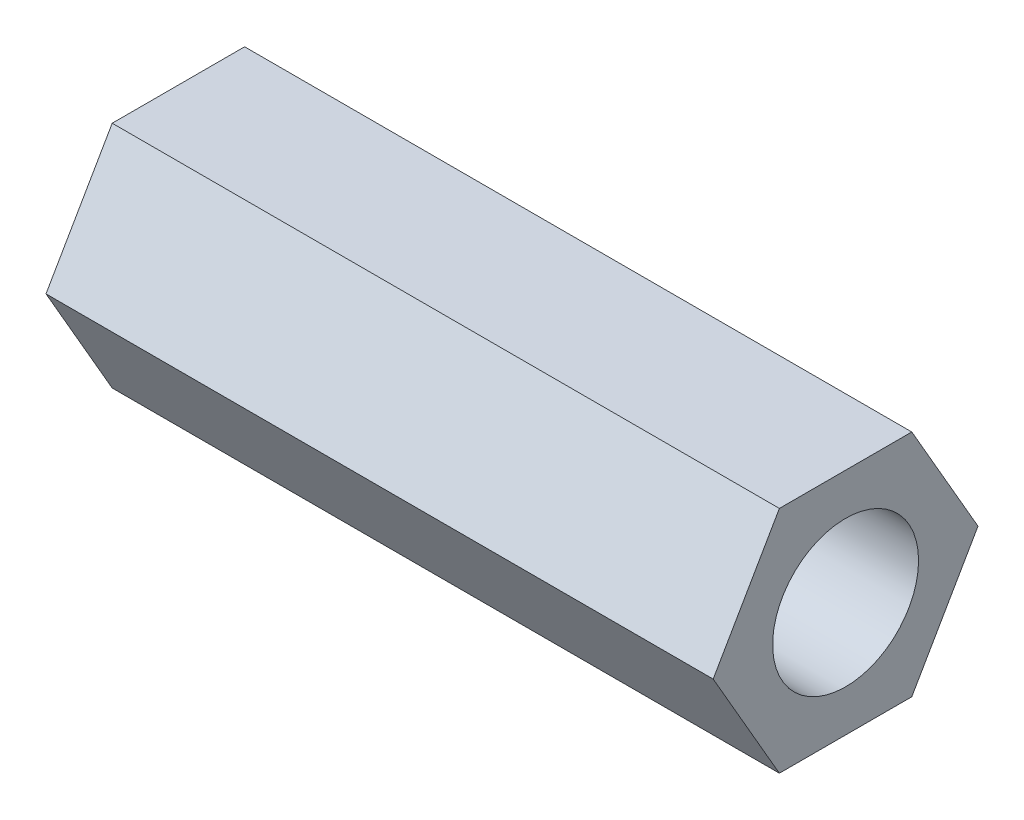
from build123d import *

# Parameters (mm, degrees)
SKETCH1_R           = 5.55625
BOSS_EXTRUDE1_DEPTH = 50.8


with BuildPart() as part:
    # Sketch1 → Boss-Extrude1 (new body)
    with BuildSketch(Plane(origin=(0, 0, 0), x_dir=(0, 0, -1), z_dir=(1, 0, 0))):
        Polygon((-10.081979076, 0), (-5.040989538, -8.73125), (5.040989538, -8.73125), (10.081979076, 0), (5.040989538, 8.73125), (-5.040989538, 8.73125), align=None)
        Circle(SKETCH1_R, mode=Mode.SUBTRACT)
    extrude(amount=BOSS_EXTRUDE1_DEPTH)


solid = part.part
